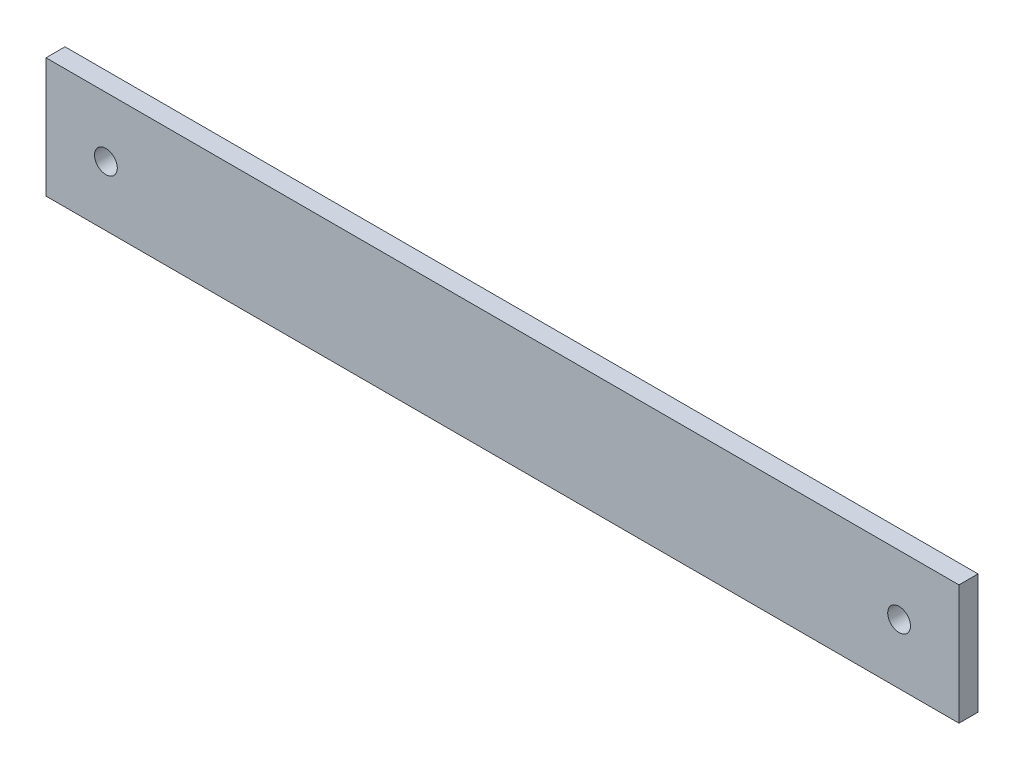
from build123d import *

# Parameters (mm, degrees)
SKETCH1_W             = 152.4
SKETCH1_H             = 20
BOSS_EXTRUDE1_DEPTH   = 3.175
F_6_CLEARANCE_HOLE1_D = 3.7973


with BuildPart() as part:
    # Sketch1 → Boss-Extrude1 (new body)
    with BuildSketch(Plane.XY):
        with Locations((76.2, 10)):
            Rectangle(SKETCH1_W, SKETCH1_H)
    extrude(amount=BOSS_EXTRUDE1_DEPTH)

    # #6 Clearance Hole1 (through all)
    with Locations(Plane(origin=(0, 0, 0), x_dir=(-1, 0, 0), z_dir=(0, 0, -1))):
        with Locations((-142.4, 10), (-10, 10)):
            Hole(F_6_CLEARANCE_HOLE1_D / 2)


solid = part.part
